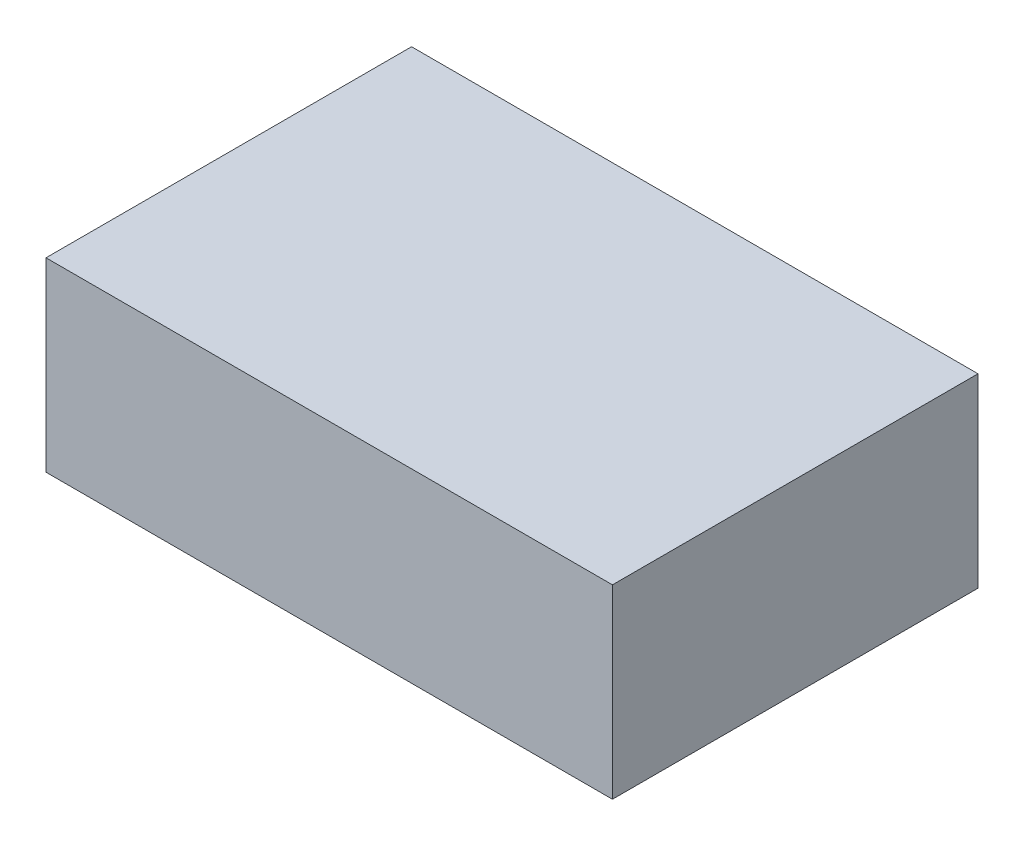
from build123d import *

# Parameters (mm, degrees)
SKETCH_1_W      = 18.3
SKETCH_1_H      = 6
EXTRUDE_1_DEPTH = 11.81


with BuildPart() as part:
    # 草圖1 → 填料-伸長1 (new body)
    with BuildSketch(Plane.XY):
        Rectangle(SKETCH_1_W, SKETCH_1_H)
    extrude(amount=EXTRUDE_1_DEPTH)


solid = part.part
